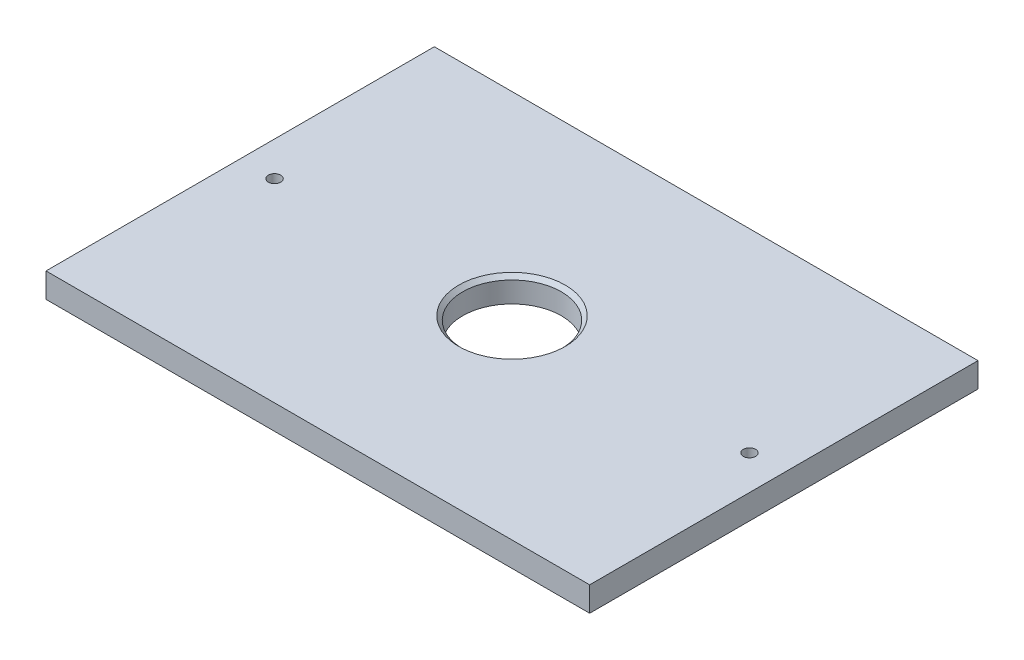
from build123d import *

# Parameters (mm, degrees)
SKETCH1_W           = 140
SKETCH1_H           = 100
BOSS_EXTRUDE1_DEPTH = 6.35
SKETCH2_R           = 12.705
CUT_EXTRUDE1_DEPTH  = 10
SKETCH3_R           = 1.5875
CUT_EXTRUDE2_DEPTH  = 10
CHAMFER1_SIZE       = 1


with BuildPart() as part:
    # Sketch1 → Boss-Extrude1 (new body)
    with BuildSketch(Plane(origin=(0, 0, 0), x_dir=(1, 0, 0), z_dir=(0, 1, 0))):
        with Locations((70, 50)):
            Rectangle(SKETCH1_W, SKETCH1_H)
    extrude(amount=BOSS_EXTRUDE1_DEPTH)

    # Sketch2 → Cut-Extrude1 (cut)
    with BuildSketch(Plane(origin=(0, 6.35, 0), x_dir=(1, 0, 0), z_dir=(0, 1, 0))):
        with Locations(Location((70, 50, 0), (0, 0, 270))):
            Circle(SKETCH2_R)
    extrude(amount=-CUT_EXTRUDE1_DEPTH, mode=Mode.SUBTRACT)

    # Sketch3 → Cut-Extrude2 (cut)
    with BuildSketch(Plane(origin=(0, 6.35, 0), x_dir=(1, 0, 0), z_dir=(0, 1, 0))):
        with Locations(Location((8.85, 50, 0), (0, 0, 270))):
            Circle(SKETCH3_R)
        with Locations(Location((131.15, 50, 0), (0, 0, 270))):
            Circle(SKETCH3_R)
    extrude(amount=-CUT_EXTRUDE2_DEPTH, mode=Mode.SUBTRACT)

    # Chamfer1
    chamfer1_edges = [part.edges().sort_by_distance(p)[0] for p in [
        (70, 6.35, -62.705),
    ]]
    chamfer(chamfer1_edges, length=CHAMFER1_SIZE)


solid = part.part
